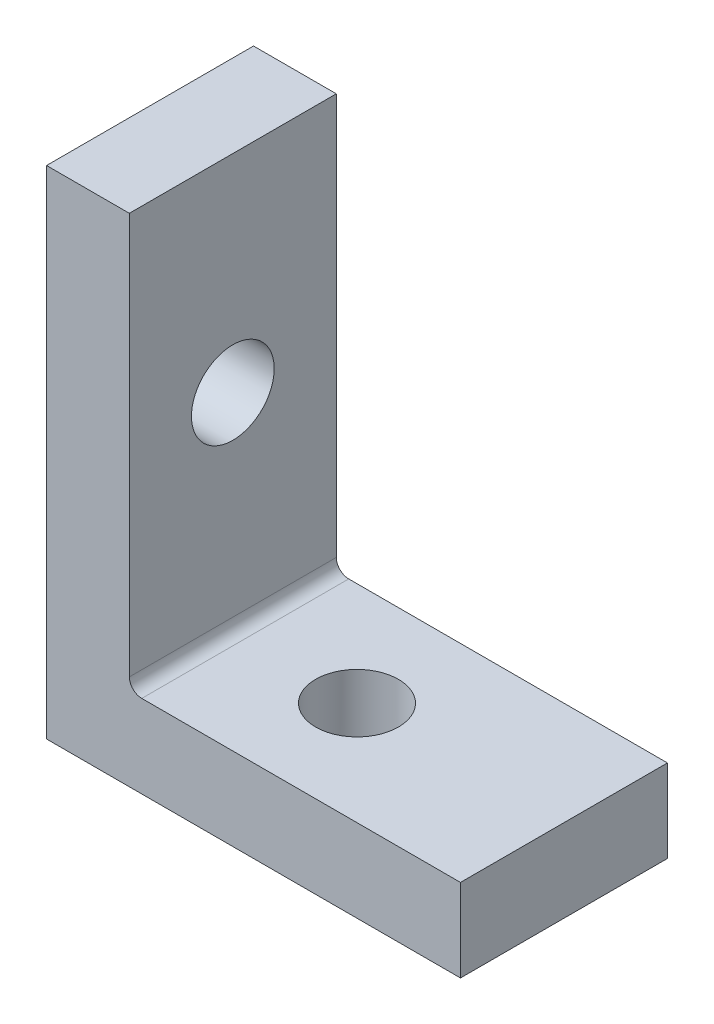
from build123d import *

# Parameters (mm, degrees)
SKETCH1_W           = 100
SKETCH1_H           = 50
BOSS_EXTRUDE1_DEPTH = 20
SKETCH3_W           = 20
SKETCH3_H           = 50
BOSS_EXTRUDE2_DEPTH = 100
SKETCH4_R           = 10
CUT_EXTRUDE1_DEPTH  = 100
SKETCH5_R           = 10
CUT_EXTRUDE2_DEPTH  = 100
FILLET1_R           = 3


with BuildPart() as part:
    # Sketch1 → Boss-Extrude1 (new body)
    with BuildSketch(Plane(origin=(0, 0, 0), x_dir=(1, 0, 0), z_dir=(0, 1, 0))):
        Rectangle(SKETCH1_W, SKETCH1_H)
    extrude(amount=BOSS_EXTRUDE1_DEPTH)

    # Sketch3 → Boss-Extrude2 (add)
    with BuildSketch(Plane(origin=(0, 20, 0), x_dir=(1, 0, 0), z_dir=(0, 1, 0))):
        with Locations((-40, 0)):
            Rectangle(SKETCH3_W, SKETCH3_H)
    extrude(amount=BOSS_EXTRUDE2_DEPTH)

    # Sketch4 → Cut-Extrude1 (cut)
    with BuildSketch(Plane(origin=(-30, 0, 0), x_dir=(0, 0, -1), z_dir=(1, 0, 0))):
        with Locations((0, 70)):
            Circle(SKETCH4_R)
    extrude(amount=-CUT_EXTRUDE1_DEPTH, mode=Mode.SUBTRACT)

    # Sketch5 → Cut-Extrude2 (cut)
    with BuildSketch(Plane(origin=(0, 20, 0), x_dir=(1, 0, 0), z_dir=(0, 1, 0))):
        with Locations(Location((0, 0, 0), (0, 0, 270))):
            Circle(SKETCH5_R)
    extrude(amount=-CUT_EXTRUDE2_DEPTH, mode=Mode.SUBTRACT)

    # Fillet1
    fillet1_edges = [part.edges().sort_by_distance(p)[0] for p in [
        (-30, 20, 0),
    ]]
    fillet(fillet1_edges, radius=FILLET1_R)


solid = part.part
